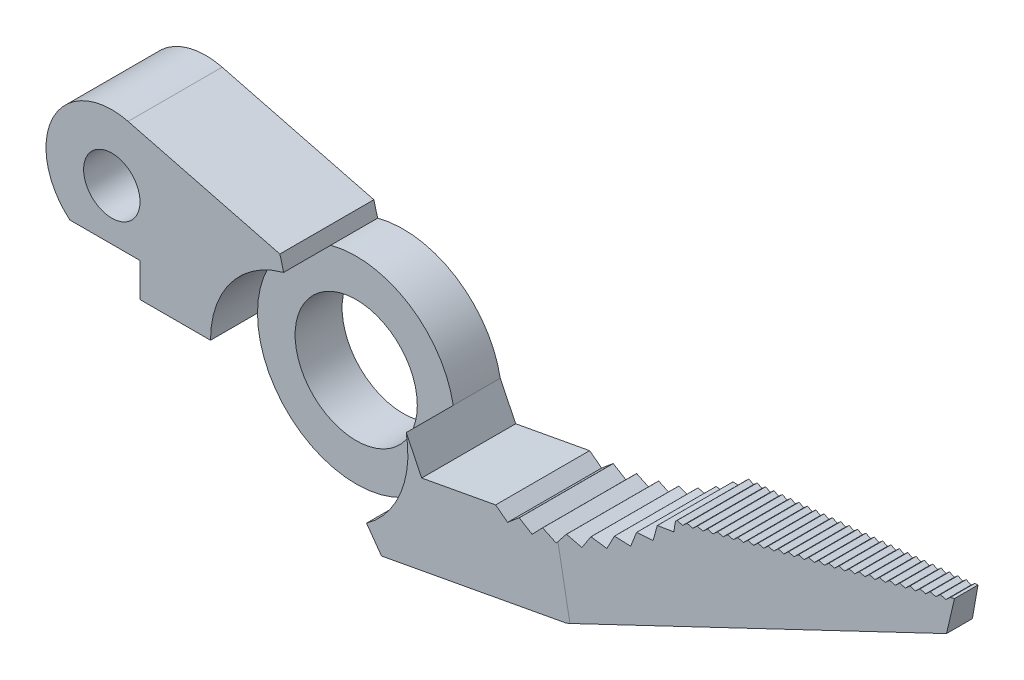
from build123d import *

# Parameters (mm, degrees)
SKETCH1_R               = 1.5
BOSS_EXTRUDE1_DEPTH     = 5
BOSS_EXTRUDE1_2_DEPTH   = 5
SKETCH1_3_R             = 5.25
BOSS_EXTRUDE2_DEPTH     = 2.5
CUT_EXTRUDE4_DEPTH      = 34.791042337
CUT_EXTRUDE4_DEPTH_BACK = 34.791042337
SKETCH1_5_R             = 3.25
CUT_EXTRUDE1_DEPTH      = 34.791042337
CUT_EXTRUDE2_DEPTH      = 34.791042337
LPATTERN1_COUNT         = 28
LPATTERN1_PITCH         = 0.5
CUT_EXTRUDE3_DEPTH      = 34.791042337
CIRPATTERN1_COUNT       = 8
CIRPATTERN1_ANGLE       = 42


with BuildPart() as part:
    # Sketch1 → Boss-Extrude1 (new body)
    with BuildSketch(Plane.XY):
        with BuildLine():
            Line((-1.559459186, 5.819980914), (-9.630372069, 7.89024295))
            ThreePointArc((-9.630372069, 7.89024295), (-13.619847961, 6.086363356), (-12.727105745, 1.8))
            Line((-12.727105745, 1.8), (-9, 1.8))
            Line((-9, 1.8), (-9, 0))
            Line((-9, 0), (-5.25, 0))
            ThreePointArc((-5.25, 0), (-4.165105037, 3.195997502), (-1.358799987, 5.071110588))
            Line((-1.358799987, 5.071110588), (-1.559459186, 5.819980914))
        make_face()
        with Locations((-10.5, 4.5)):
            Circle(SKETCH1_R, mode=Mode.SUBTRACT)
    extrude(amount=BOSS_EXTRUDE1_DEPTH)



with BuildPart() as body_2:
    # Sketch1 → Boss-Extrude1 2 (new body)
    with BuildSketch(Plane.XY):
        with BuildLine():
            Line((5.983025461, -0.728942102), (5.162088265, 0.956736509))
            ThreePointArc((5.162088265, 0.956736509), (4.867715236, -1.966684615), (3.048690517, -4.274106471))
            Line((3.048690517, -4.274106471), (3.844408913, -5.389662519))
            Line((3.844408913, -5.389662519), (13.676957988, -3.567307264))
            Line((13.676957988, -3.567307264), (32.08570782, 4.250488438))
            Line((32.08570782, 4.250488438), (32.44741195, 6.013772341))
            Line((32.44741195, 6.013772341), (18.681843244, 3.462474984))
            ThreePointArc((18.681843244, 3.462474984), (14.653100202, 0.834635979), (9.916045092, 0))
            Line((9.916045092, 0), (5.983025461, -0.728942102))
        make_face()
    extrude(amount=BOSS_EXTRUDE1_2_DEPTH)


with BuildPart() as part_1:
    add(part.part)

    add(body_2.part)  # Boss-Extrude2 merges body 2
    # Sketch1<3> → Boss-Extrude2 (add)
    with BuildSketch(Plane.XY):
        Circle(SKETCH1_3_R)
    extrude(amount=BOSS_EXTRUDE2_DEPTH)

    # Sketch1<5> → Cut-Extrude4 (cut, two sides: drawn at the far end of the back side and taken through both)
    with BuildSketch(Plane.XY.offset(-CUT_EXTRUDE4_DEPTH_BACK)):
        Circle(SKETCH1_5_R)
    extrude(amount=CUT_EXTRUDE4_DEPTH + CUT_EXTRUDE4_DEPTH_BACK, mode=Mode.SUBTRACT)

    # Sketch2 → Cut-Extrude1 (cut, through all)
    with BuildSketch(Plane(origin=(0, 0, 0), x_dir=(0.9832549075639557, 0.18223552549214142, 0), z_dir=(-0.18223552549214142, 0.9832549075639557, 0))):
        Polygon((13, 0), (33, -1.875), (33, 0), align=None)
        Polygon((33, -3.125), (33, -5), (13, -5), align=None)
    extrude(amount=-CUT_EXTRUDE1_DEPTH, mode=Mode.SUBTRACT)

    # Sketch3 → Cut-Extrude2 (cut, symmetric)
    with BuildSketch(Plane.XY):
        Polygon((31.759133514, 5.886207473), (32.03228257, 5.784278119), (32.250760968, 5.977325236), align=None)
    cut_extrude2 = extrude(amount=CUT_EXTRUDE2_DEPTH, both=True, mode=Mode.SUBTRACT)

    # LPattern1: Cut-Extrude2 ×28
    with Locations(*[Vector(-0.983254907563956, -0.1822355254921403, 0) * (i * LPATTERN1_PITCH) for i in range(1, LPATTERN1_COUNT)]):
        add(cut_extrude2, mode=Mode.SUBTRACT)

    # Sketch4 → Cut-Extrude3 (cut, through all)
    with BuildSketch(Plane.XY):
        Polygon((9.916045092, 0), (11.165663009, 0.030904073), (10.553215679, -0.48439513), align=None)
    cut_extrude3 = extrude(amount=CUT_EXTRUDE3_DEPTH, mode=Mode.SUBTRACT)

    # CirPattern1: Cut-Extrude3 ×8 about axis
    cirpattern1_axis = Axis((10.244577616, 11.995501923, 0), (0, 0, 1))
    for i in range(1, CIRPATTERN1_COUNT):
        add(cut_extrude3.rotate(cirpattern1_axis, i * CIRPATTERN1_ANGLE / (CIRPATTERN1_COUNT - 1)), mode=Mode.SUBTRACT)


solid = part_1.part
